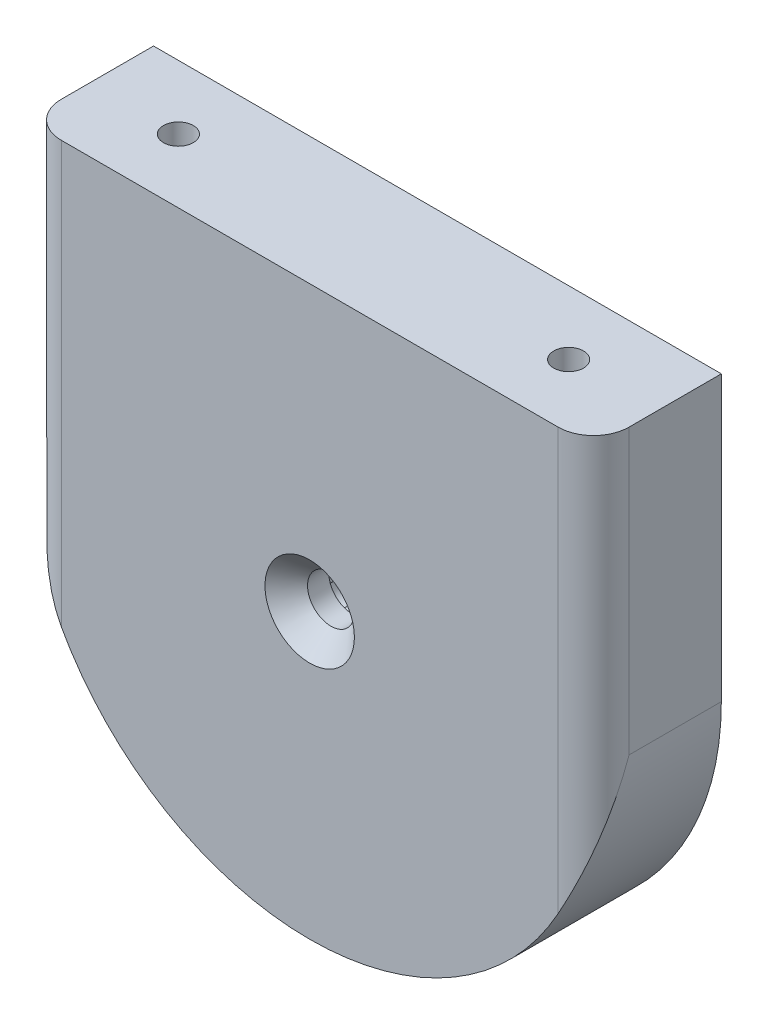
from build123d import *

# Parameters (mm, degrees)
SKETCH1_W                                           = 80
SKETCH1_H                                           = 80
BOSS_EXTRUDE1_DEPTH                                 = 12
SKETCH2_W                                           = 80
SKETCH2_H                                           = 80
SKETCH2_R                                           = 1.5
BOSS_EXTRUDE2_DEPTH                                 = 6
CSK_FOR_M6_COUNTERSUNK_FLAT_HEAD_SCREW1_D           = 6.6
CSK_FOR_M6_COUNTERSUNK_FLAT_HEAD_SCREW1_DEPTH       = 10
CSK_FOR_M6_COUNTERSUNK_FLAT_HEAD_SCREW1_CSINK_D     = 12.6
CSK_FOR_M6_COUNTERSUNK_FLAT_HEAD_SCREW1_CSINK_ANGLE = 90
CSK_FOR_M6_COUNTERSUNK_FLAT_HEAD_SCREW1_TIP         = 1.982840043
FILLET1_R                                           = 5
M5_TAPPED_HOLE1_D                                   = 4.2
M5_TAPPED_HOLE1_DEPTH                               = 12.4
M5_TAPPED_HOLE1_TIP                                 = 1.2618073
CUT_EXTRUDE1_DEPTH                                  = 60.363288319


with BuildPart() as part:
    # Sketch1 → Boss-Extrude1 (new body)
    with BuildSketch(Plane.XY):
        Rectangle(SKETCH1_W, SKETCH1_H)
        with BuildLine():
            Line((6, -8), (-6, -8))
            ThreePointArc((-6, -8), (-9.414213562, -9.414213562), (-8, -6))
            Line((-8, -6), (-8, 6))
            ThreePointArc((-8, 6), (-9.414213562, 9.414213562), (-6, 8))
            Line((-6, 8), (6, 8))
            ThreePointArc((6, 8), (8, 10), (10, 8))
            ThreePointArc((10, 8), (9.414213562, 6.585786438), (8, 6))
            Line((8, 6), (8, -6))
            ThreePointArc((8, -6), (9.414213562, -6.585786438), (10, -8))
            ThreePointArc((10, -8), (8, -10), (6, -8))
        make_face(mode=Mode.SUBTRACT)
    extrude(amount=BOSS_EXTRUDE1_DEPTH)

    # Sketch2 → Boss-Extrude2 (add)
    with BuildSketch(Plane.XY.offset(12)):
        Rectangle(SKETCH2_W, SKETCH2_H)
        Circle(SKETCH2_R, mode=Mode.SUBTRACT)
    extrude(amount=BOSS_EXTRUDE2_DEPTH)

    # CSK for M6 Countersunk Flat Head Screw1
    with Locations(Plane.XY.offset(18)):
        with Locations((0, 0)):
            CounterSinkHole(CSK_FOR_M6_COUNTERSUNK_FLAT_HEAD_SCREW1_D / 2, CSK_FOR_M6_COUNTERSUNK_FLAT_HEAD_SCREW1_CSINK_D / 2, depth=CSK_FOR_M6_COUNTERSUNK_FLAT_HEAD_SCREW1_DEPTH, counter_sink_angle=CSK_FOR_M6_COUNTERSUNK_FLAT_HEAD_SCREW1_CSINK_ANGLE)
            with Locations((0, 0, -(CSK_FOR_M6_COUNTERSUNK_FLAT_HEAD_SCREW1_DEPTH + CSK_FOR_M6_COUNTERSUNK_FLAT_HEAD_SCREW1_TIP / 2))):  # 118° drill point
                Cone(0, CSK_FOR_M6_COUNTERSUNK_FLAT_HEAD_SCREW1_D / 2, CSK_FOR_M6_COUNTERSUNK_FLAT_HEAD_SCREW1_TIP, mode=Mode.SUBTRACT)

    # Fillet1
    fillet1_edges = [part.edges().sort_by_distance(p)[0] for p in [
        (-40, 0, 18),
        (40, 0, 18),
    ]]
    fillet(fillet1_edges, radius=FILLET1_R)

    # M5 Tapped Hole1
    with Locations(Plane(origin=(0, 40, 0), x_dir=(1, 0, 0), z_dir=(0, 1, 0))):
        with Locations((-27.5, -9), (27.5, -9.012634245)):
            Hole(M5_TAPPED_HOLE1_D / 2, depth=M5_TAPPED_HOLE1_DEPTH)
            with Locations((0, 0, -(M5_TAPPED_HOLE1_DEPTH + M5_TAPPED_HOLE1_TIP / 2))):  # 118° drill point
                Cone(0, M5_TAPPED_HOLE1_D / 2, M5_TAPPED_HOLE1_TIP, mode=Mode.SUBTRACT)

    # Sketch7 → Cut-Extrude1 (cut, through all)
    with BuildSketch(Plane.XY.offset(18)):
        with BuildLine():
            ThreePointArc((0, -40), (-20.315060063, -34.457195687), (-35, -19.364916731))
            Line((-35, -19.364916731), (-35, -40))
            Line((-35, -40), (0, -40))
        make_face()
        with BuildLine():
            ThreePointArc((-35, -19.364916731), (-38.729833462, -10), (-40, 0))
            Line((-40, 0), (-40, -40))
            Line((-40, -40), (-35, -40))
            Line((-35, -40), (-35, -19.364916731))
        make_face()
        with BuildLine():
            ThreePointArc((35, -19.364916731), (20.315060063, -34.457195687), (0, -40))
            Line((0, -40), (35, -40))
            Line((35, -40), (35, -19.364916731))
        make_face()
        with BuildLine():
            Line((35, -19.364916731), (35, -40))
            Line((35, -40), (40, -40))
            Line((40, -40), (40, 0))
            ThreePointArc((40, 0), (38.729833462, -10), (35, -19.364916731))
        make_face()
    extrude(amount=-CUT_EXTRUDE1_DEPTH, mode=Mode.SUBTRACT)


solid = part.part
